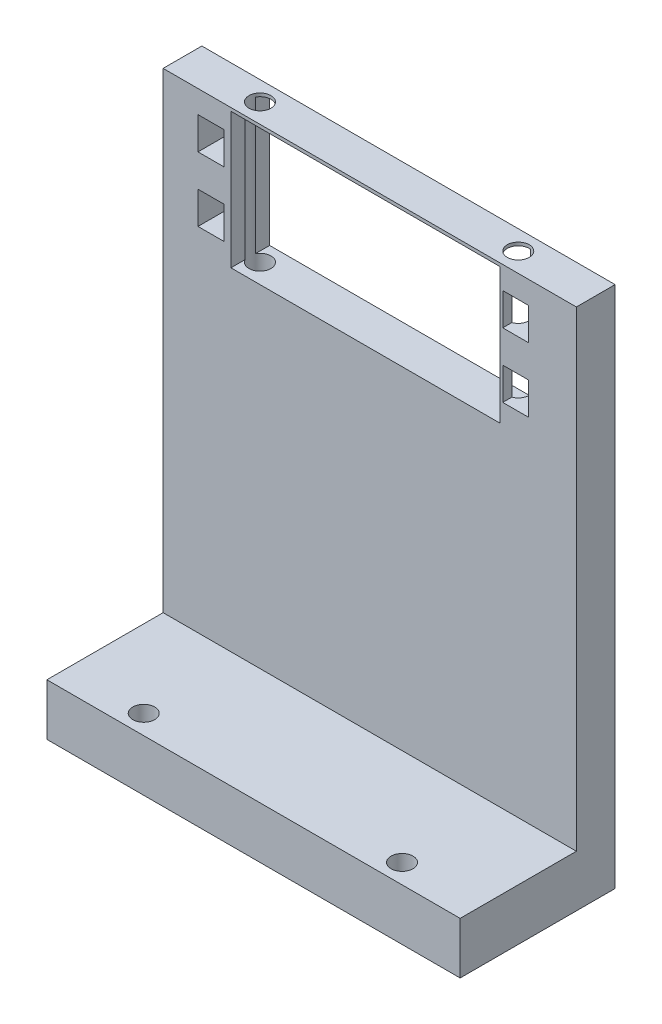
from build123d import *

# Parameters (mm, degrees)
SKETCH_1_W                                      = 64
SKETCH_1_H                                      = 8
SERVO_FOOT_DEPTH                                = 24
SKETCH_2_W                                      = 64
SKETCH_2_H                                      = 81
SERVO_FACE_PLATE_DEPTH                          = 6
MG995_BODY_WINDOW_REFERENCE_DEPTH               = 95.794514609
MG995_BODY_WINDOW_REFERENCE_DEPTH_BACK          = 95.794514609
SKETCH_3_W                                      = 41.7
SKETCH_3_H                                      = 21
MG995_47P2X10_REFERENCE_SLOTS_VERIFY_DEPTH      = 95.794514609
MG995_47P2X10_REFERENCE_SLOTS_VERIFY_DEPTH_BACK = 95.794514609
SKETCH_4_W                                      = 4
SKETCH_4_H                                      = 5
SERVO_FOOT_M3_DEPTH                             = 95.794514609
SERVO_FOOT_M3_DEPTH_BACK                        = 95.794514609
SKETCH_5_R                                      = 1.7


with BuildPart() as part:
    # 草图1 → Servo_foot (new body)
    with BuildSketch(Plane.XY):
        with Locations((11, 4)):
            Rectangle(SKETCH_1_W, SKETCH_1_H)
    extrude(amount=SERVO_FOOT_DEPTH)

    # 草图2 → Servo_face_plate (add)
    with BuildSketch(Plane.XY):
        with Locations((11, 40.5)):
            Rectangle(SKETCH_2_W, SKETCH_2_H)
    extrude(amount=SERVO_FACE_PLATE_DEPTH)

    # 草图3 → MG995_body_window_REFERENCE (cut, two sides: drawn at the far end of the back side and taken through both)
    with BuildSketch(Plane.XY.offset(-MG995_BODY_WINDOW_REFERENCE_DEPTH_BACK)):
        with Locations((10.35, 70)):
            Rectangle(SKETCH_3_W, SKETCH_3_H)
    extrude(amount=MG995_BODY_WINDOW_REFERENCE_DEPTH + MG995_BODY_WINDOW_REFERENCE_DEPTH_BACK, mode=Mode.SUBTRACT)

    # 草图4 → MG995_47p2x10_reference_slots_VERIFY (cut, two sides: drawn at the far end of the back side and taken through both)
    with BuildSketch(Plane.XY.offset(-MG995_47P2X10_REFERENCE_SLOTS_VERIFY_DEPTH_BACK)):
        with Locations((-13.6, 65)):
            Rectangle(SKETCH_4_W, SKETCH_4_H)
        with Locations((-13.6, 75)):
            Rectangle(SKETCH_4_W, SKETCH_4_H)
        with Locations((33.6, 65)):
            Rectangle(SKETCH_4_W, SKETCH_4_H)
        with Locations((33.6, 75)):
            Rectangle(SKETCH_4_W, SKETCH_4_H)
    extrude(amount=MG995_47P2X10_REFERENCE_SLOTS_VERIFY_DEPTH + MG995_47P2X10_REFERENCE_SLOTS_VERIFY_DEPTH_BACK, mode=Mode.SUBTRACT)

    # 草图5 → Servo_foot_M3 (cut, two sides: drawn at the far end of the back side and taken through both)
    with BuildSketch(Plane(origin=(0, 0, 0), x_dir=(1, 0, 0), z_dir=(0, 1, 0)).offset(-SERVO_FOOT_M3_DEPTH_BACK)):
        with Locations(Location((-9, -3, 0), (0, 0, 270))):
            Circle(SKETCH_5_R)
        with Locations(Location((-9, -21, 0), (0, 0, 270))):
            Circle(SKETCH_5_R)
        with Locations(Location((31, -3, 0), (0, 0, 270))):
            Circle(SKETCH_5_R)
        with Locations(Location((31, -21, 0), (0, 0, 270))):
            Circle(SKETCH_5_R)
    extrude(amount=SERVO_FOOT_M3_DEPTH + SERVO_FOOT_M3_DEPTH_BACK, mode=Mode.SUBTRACT)


solid = part.part
